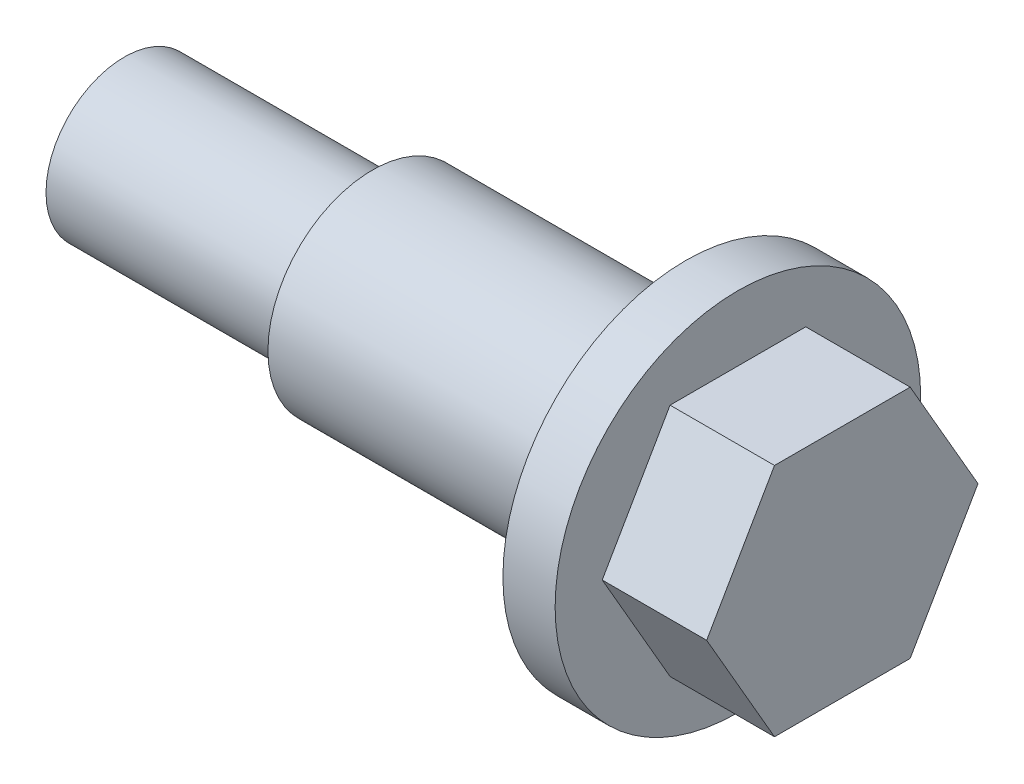
from build123d import *

# Parameters (mm, degrees)
BOSS_EXTRUDE1_DEPTH = 4


with BuildPart() as part:
    # Sketch1 → Revolve1 (revolve)
    with BuildSketch(Plane.XY, mode=Mode.PRIVATE) as revolve1_sk:
        Polygon((0, 0), (0, 3), (9.5, 3), (9.5, 4), (21.5, 4), (21.5, 7), (23.5, 7), (23.5, 4.5), (27.5, 4.5), (27.5, 0), align=None)
    revolve(revolve1_sk.sketch.rotate(Axis((0, 0, 0), (1, 0, 0)), 90), axis=Axis((0, 0, 0), (1, 0, 0)))

    # Sketch2 → Boss-Extrude1 (add)
    with BuildSketch(Plane(origin=(27.5, 0, 0), x_dir=(0, 0, -1), z_dir=(1, 0, 0))):
        Polygon((-2.598076211, 4.5), (-5.196152423, 0), (-2.598076211, -4.5), (2.598076211, -4.5), (5.196152423, 0), (2.598076211, 4.5), align=None)
    extrude(amount=-BOSS_EXTRUDE1_DEPTH)


solid = part.part
